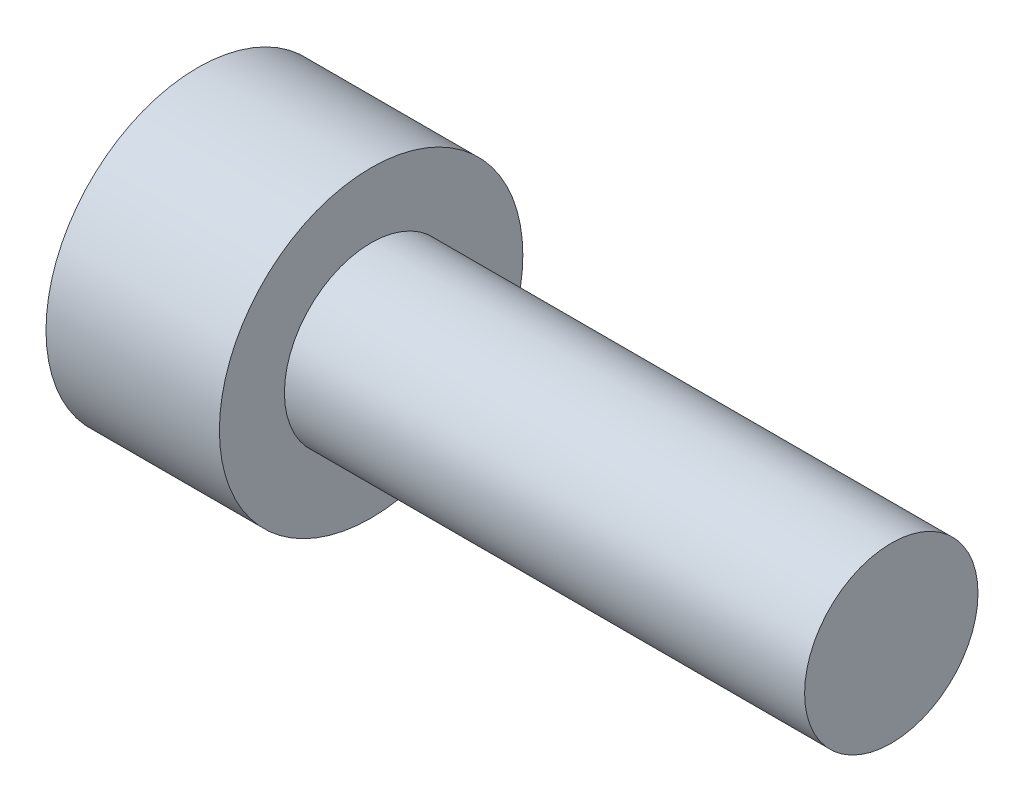
from build123d import *

# Parameters (mm, degrees)
CUT_EXTRUDE1_DEPTH = 2


with BuildPart() as part:
    # Sketch1 → Revolve1 (revolve)
    with BuildSketch(Plane.XY, mode=Mode.PRIVATE) as revolve1_sk:
        Polygon((0, 0), (0, 3.5), (4, 3.5), (4, 2), (16, 2), (16, 0), align=None)
    revolve(revolve1_sk.sketch.rotate(Axis((0, 0, 0), (1, 0, 0)), 90), axis=Axis((0, 0, 0), (1, 0, 0)))

    # Sketch2 → Cut-Revolve1 (revolve, cut)
    with BuildSketch(Plane.XY, mode=Mode.PRIVATE) as cut_revolve1_sk:
        Polygon((0, 1.5), (2, 1.5), (2.866025404, 0), (0, 0), align=None)
    revolve(cut_revolve1_sk.sketch.rotate(Axis((0, 0, 0), (1, 0, 0)), 180), axis=Axis((0, 0, 0), (1, 0, 0)), mode=Mode.SUBTRACT)

    # Sketch3 → Cut-Extrude1 (cut)
    with BuildSketch(Plane.ZY):
        Polygon((0, -1.732050808), (1.5, -0.866025404), (1.5, 0.866025404), (0, 1.732050808), (-1.5, 0.866025404), (-1.5, -0.866025404), align=None)
    extrude(amount=-CUT_EXTRUDE1_DEPTH, mode=Mode.SUBTRACT)


solid = part.part
